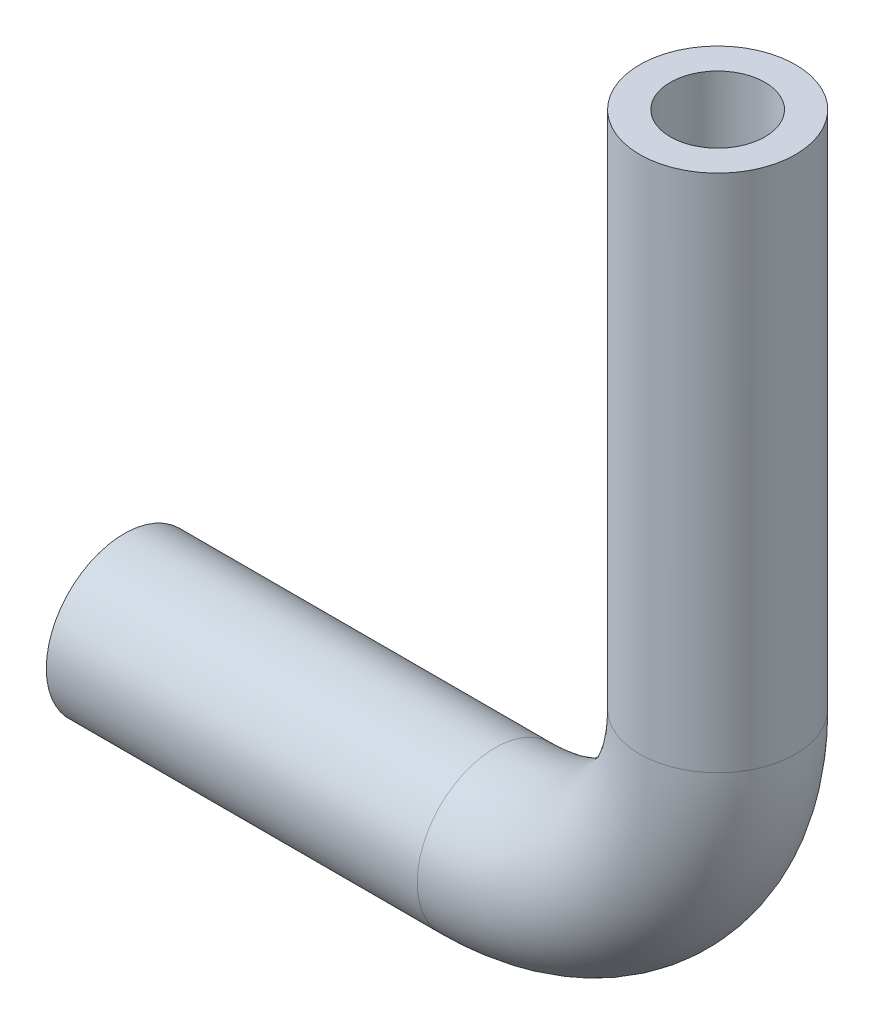
from build123d import *

# Parameters (mm, degrees)
SKETCH3_R   = 10.5
SKETCH3_R_2 = 6.375


with BuildPart() as part:
    # Sweep1: sweep along a path in Sketch2
    with BuildLine(Plane.XY) as sweep1_path:
        Line((0, 0), (0, -70))
        ThreePointArc((0, -70), (-8.786796564, -91.213203436), (-30, -100))
        Line((-30, -100), (-80, -100))
    # Sketch3 → Sweep1 (sweep)
    with BuildSketch(Plane(origin=(0, 0, 0), x_dir=(1, 0, 0), z_dir=(0, 1, 0))):
        Circle(SKETCH3_R)
        Circle(SKETCH3_R_2, mode=Mode.SUBTRACT)
    sweep(path=sweep1_path.line)


solid = part.part
